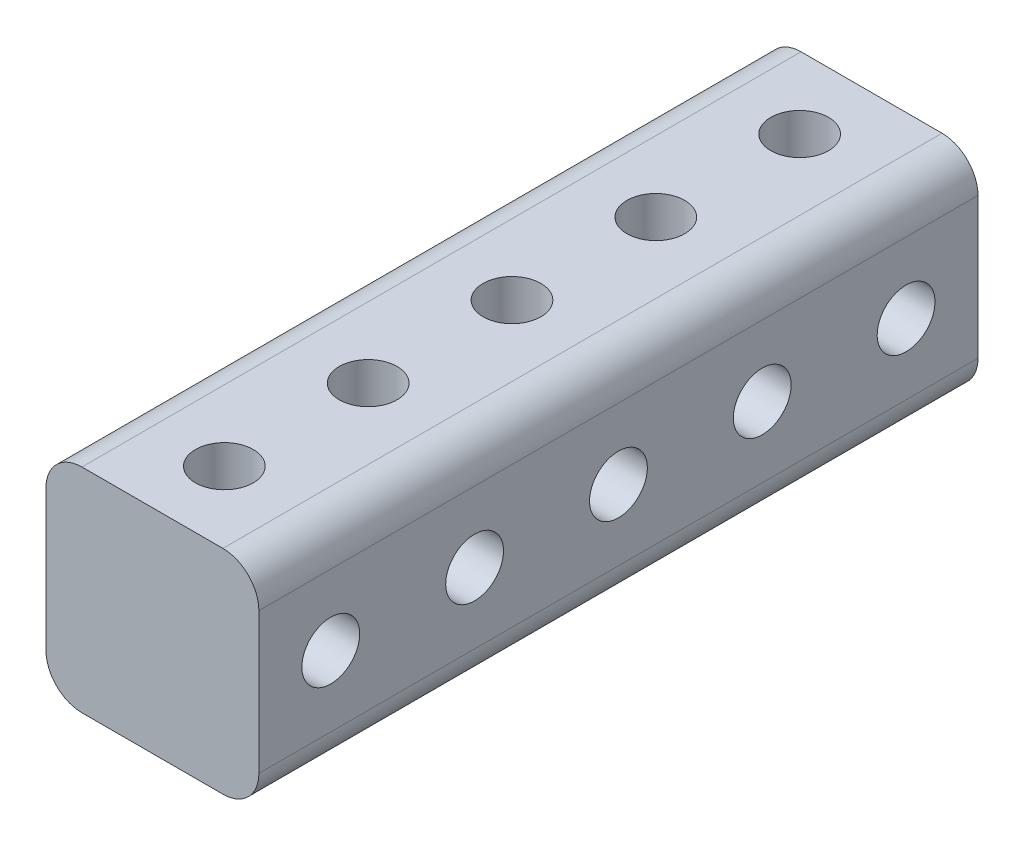
from build123d import *

# Parameters (mm, degrees)
SKETCH1_W           = 18.796
SKETCH1_H           = 18.796
BOSS_EXTRUDE1_DEPTH = 63.5
FILLET1_R           = 3.175
SKETCH2_R           = 2.5527
CUT_EXTRUDE1_DEPTH  = 63.5
SKETCH3_R           = 2.5527
CUT_EXTRUDE2_DEPTH  = 63.5


with BuildPart() as part:
    # Sketch1 → Boss-Extrude1 (new body)
    with BuildSketch(Plane.XY):
        with Locations((9.398, 9.398)):
            Rectangle(SKETCH1_W, SKETCH1_H)
    extrude(amount=BOSS_EXTRUDE1_DEPTH)

    # Fillet1
    fillet1_edges = [part.edges().sort_by_distance(p)[0] for p in [
        (0, 18.796, 31.75),
        (18.796, 18.796, 31.75),
        (18.796, 0, 31.75),
        (0, 0, 31.75),
    ]]
    fillet(fillet1_edges, radius=FILLET1_R)

    # Sketch2 → Cut-Extrude1 (cut)
    with BuildSketch(Plane(origin=(0, 18.796, 0), x_dir=(1, 0, 0), z_dir=(0, 1, 0))):
        with Locations(Location((9.398, -6.35, 0), (0, 0, 270))):
            Circle(SKETCH2_R)
        with Locations(Location((9.398, -19.05, 0), (0, 0, 270))):
            Circle(SKETCH2_R)
        with Locations(Location((9.398, -31.75, 0), (0, 0, 270))):
            Circle(SKETCH2_R)
        with Locations(Location((9.398, -44.45, 0), (0, 0, 270))):
            Circle(SKETCH2_R)
        with Locations(Location((9.398, -57.15, 0), (0, 0, 270))):
            Circle(SKETCH2_R)
    extrude(amount=-CUT_EXTRUDE1_DEPTH, mode=Mode.SUBTRACT)

    # Sketch3 → Cut-Extrude2 (cut)
    with BuildSketch(Plane(origin=(18.796, 0, 0), x_dir=(0, 0, -1), z_dir=(1, 0, 0))):
        with Locations(Location((-57.15, 9.398, 0), (0, 0, 90))):
            Circle(SKETCH3_R)
        with Locations(Location((-44.45, 9.398, 0), (0, 0, 90))):
            Circle(SKETCH3_R)
        with Locations(Location((-31.75, 9.398, 0), (0, 0, 90))):
            Circle(SKETCH3_R)
        with Locations(Location((-19.05, 9.398, 0), (0, 0, 90))):
            Circle(SKETCH3_R)
        with Locations(Location((-6.35, 9.398, 0), (0, 0, 90))):
            Circle(SKETCH3_R)
    extrude(amount=-CUT_EXTRUDE2_DEPTH, mode=Mode.SUBTRACT)


solid = part.part
